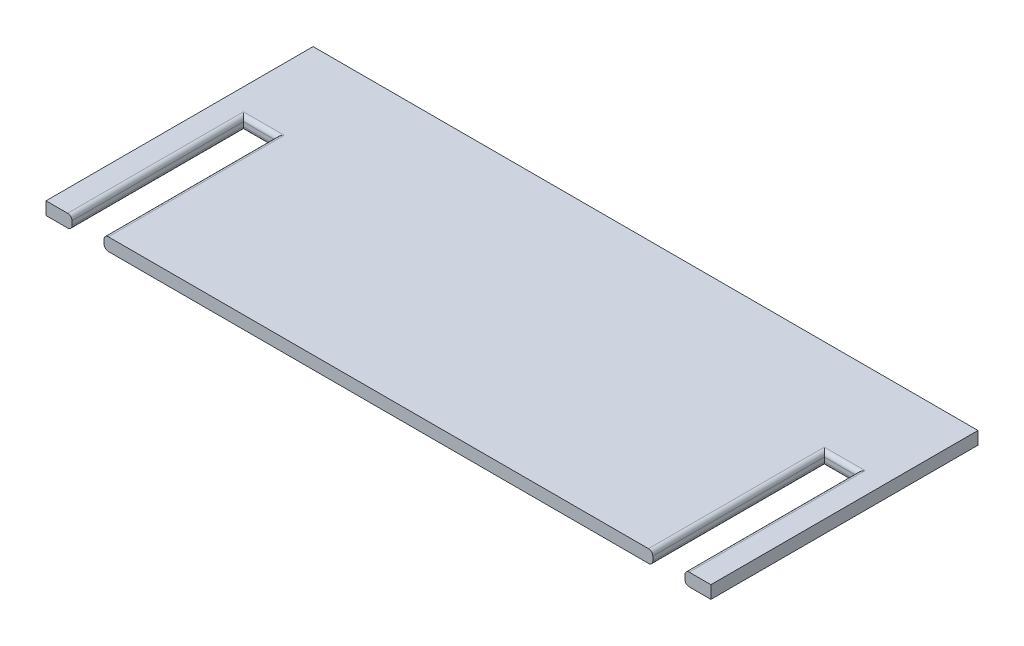
from build123d import *

# Parameters (mm, degrees)
SKETCH1_W            = 62.28
SKETCH1_H            = 2.98
BOSS_EXTRUDE1_DEPTH  = 155.03
SKETCH2_W            = 7.5
SKETCH2_H            = 40
CUT_EXTRUDE1_DEPTH   = 159.154610745
FILLET1_R            = 1
FILLET1_OF_MIRROR1_R = 1


with BuildPart() as part:
    # Sketch1 → Boss-Extrude1 (new body)
    with BuildSketch(Plane(origin=(0, 0, 0), x_dir=(0, 0, -1), z_dir=(1, 0, 0))):
        Rectangle(SKETCH1_W, SKETCH1_H)
    extrude(amount=BOSS_EXTRUDE1_DEPTH)

    # Sketch2 → Cut-Extrude1 (cut, through all)
    with BuildSketch(Plane(origin=(0, 1.49, 0), x_dir=(1, 0, 0), z_dir=(0, 1, 0))):
        with Locations((9.795259857, -11.14)):
            Rectangle(SKETCH2_W, SKETCH2_H)
    cut_extrude1 = extrude(amount=-CUT_EXTRUDE1_DEPTH, mode=Mode.SUBTRACT)

    # Fillet1
    fillet1_edges = [part.edges().sort_by_distance(p)[0] for p in [
        (13.545259857, -1.49, 11.14),
        (6.045259857, -1.49, 11.14),
        (9.795259857, -1.49, -8.86),
        (13.545259857, 1.49, 11.14),
        (9.795259857, 1.49, -8.86),
        (6.045259857, 1.49, 11.14),
    ]]
    fillet(fillet1_edges, radius=FILLET1_R)

    # Mirror1: Cut-Extrude1 across plane
    add(cut_extrude1.mirror(Plane(origin=(77.515, 0, 0), x_dir=(0, 0, 1), z_dir=(1, 0, 0))), mode=Mode.SUBTRACT)

    # Fillet1 of Mirror1
    fillet1_of_mirror1_edges = [part.edges().sort_by_distance(p)[0] for p in [
        (141.484740143, -1.49, 11.14),
        (148.984740143, -1.49, 11.14),
        (145.234740143, -1.49, -8.86),
        (141.484740143, 1.49, 11.14),
        (145.234740143, 1.49, -8.86),
        (148.984740143, 1.49, 11.14),
    ]]
    fillet(fillet1_of_mirror1_edges, radius=FILLET1_OF_MIRROR1_R)


solid = part.part
